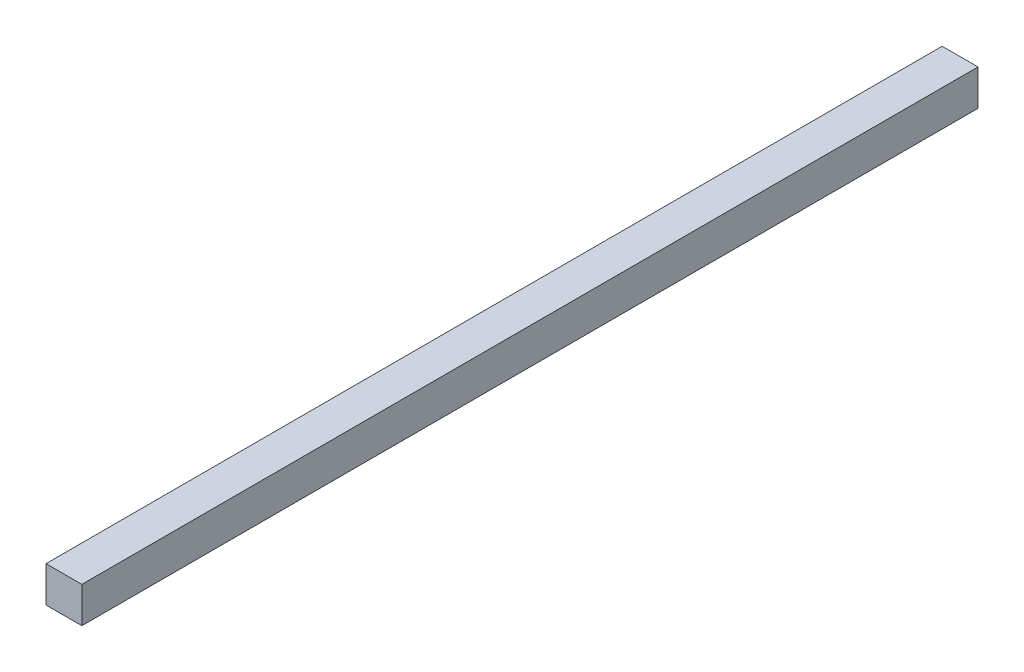
from build123d import *

# Parameters (mm, degrees)
SKETCH1_W           = 20
SKETCH1_H           = 20
BOSS_EXTRUDE1_DEPTH = 500


with BuildPart() as part:
    # Sketch1 → Boss-Extrude1 (new body)
    with BuildSketch(Plane.XY):
        Rectangle(SKETCH1_W, SKETCH1_H)
    extrude(amount=BOSS_EXTRUDE1_DEPTH)


solid = part.part
